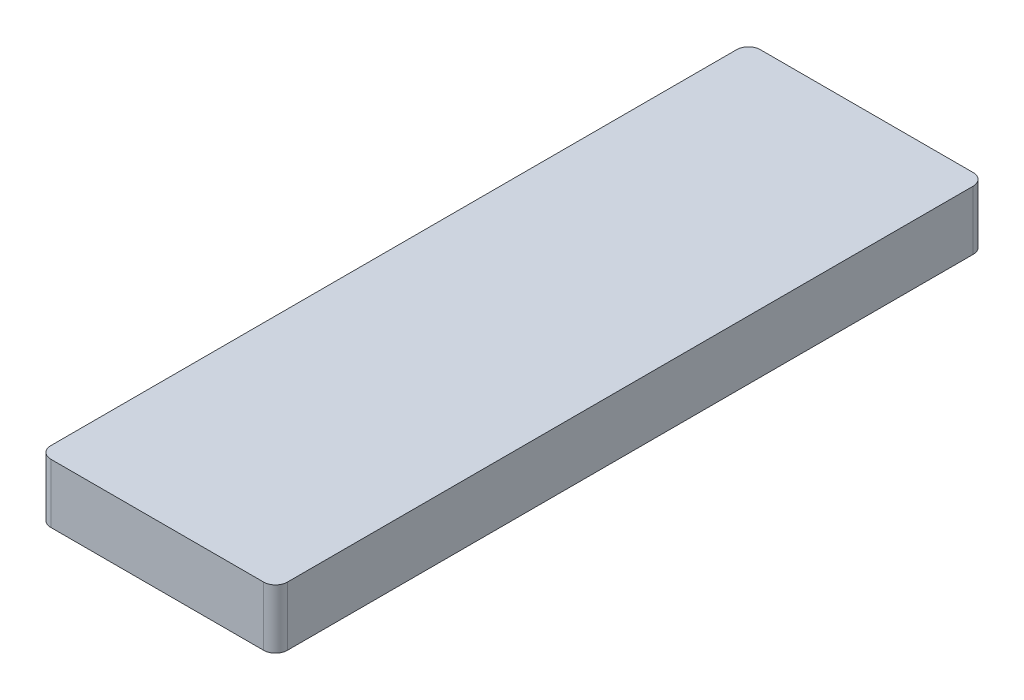
from build123d import *

# Parameters (mm, degrees)
BOSS_EXTRUDE1_DEPTH = 12.7


with BuildPart() as part:
    # Sketch2 → Boss-Extrude1 (new body)
    with BuildSketch(Plane(origin=(0, 0, 0), x_dir=(1, 0, 0), z_dir=(0, 1, 0))):
        with BuildLine():
            Line((2.54, 0), (48.26, 0))
            ThreePointArc((48.26, 0), (50.056051224, 0.743948776), (50.8, 2.54))
            Line((50.8, 2.54), (50.8, 149.86))
            ThreePointArc((50.8, 149.86), (50.056051224, 151.656051224), (48.26, 152.4))
            Line((48.26, 152.4), (2.54, 152.4))
            ThreePointArc((2.54, 152.4), (0.743948776, 151.656051224), (0, 149.86))
            Line((0, 149.86), (0, 2.54))
            ThreePointArc((0, 2.54), (0.743948776, 0.743948776), (2.54, 0))
        make_face()
    extrude(amount=BOSS_EXTRUDE1_DEPTH)


solid = part.part
